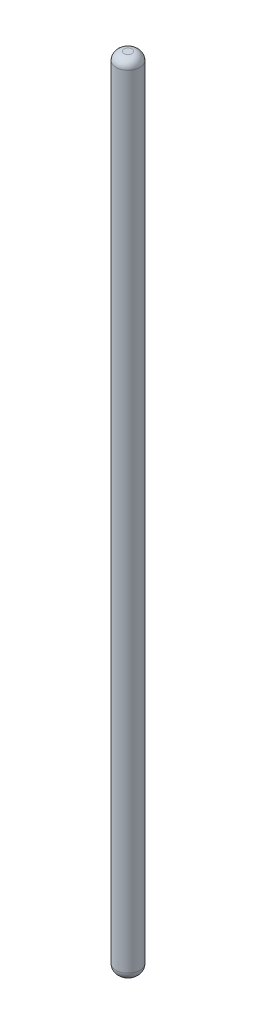
from build123d import *

# Parameters (mm, degrees)
SKETCH1_R           = 1.5
BOSS_EXTRUDE1_DEPTH = 100
FILLET1_R           = 1


with BuildPart() as part:
    # Sketch1 → Boss-Extrude1 (new body)
    with BuildSketch(Plane(origin=(0, 0, 0), x_dir=(1, 0, 0), z_dir=(0, 1, 0))):
        with Locations(Location((0, 0, 0), (0, 0, 270))):
            Circle(SKETCH1_R)
    extrude(amount=BOSS_EXTRUDE1_DEPTH)

    # Fillet1
    fillet1_edges = [part.edges().sort_by_distance(p)[0] for p in [
        (0, 0, -1.5),
        (0, 100, -1.5),
    ]]
    fillet(fillet1_edges, radius=FILLET1_R)


solid = part.part
